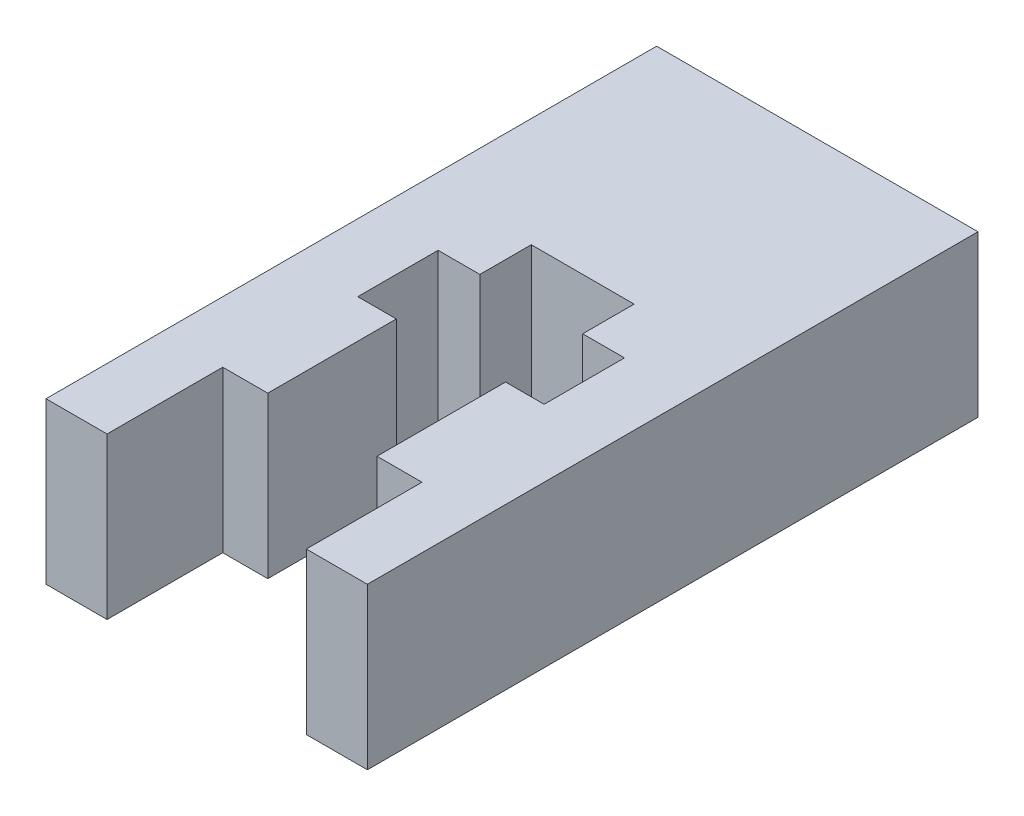
from build123d import *

# Parameters (mm, degrees)
BOSS_EXTRUDE1_DEPTH = 5


with BuildPart() as part:
    # Sketch1 → Boss-Extrude1 (new body)
    with BuildSketch(Plane(origin=(0, 0, 0), x_dir=(1, 0, 0), z_dir=(0, 1, 0))):
        Polygon((1.6, 0.6), (1.6, 2.2), (-1.6, 2.2), (-1.6, 0.6), (-2.9, 0.6), (-2.9, -1.9), (-1.7, -1.9), (-1.7, -5.9), (-3.1, -5.9), (-3.1, -9.5), (-5, -9.5), (-5, 9.5), (5, 9.5), (5, -9.5), (3.1, -9.5), (3.1, -5.9), (1.7, -5.9), (1.7, -1.9), (2.9, -1.9), (2.9, 0.6), align=None)
    extrude(amount=BOSS_EXTRUDE1_DEPTH)


solid = part.part
